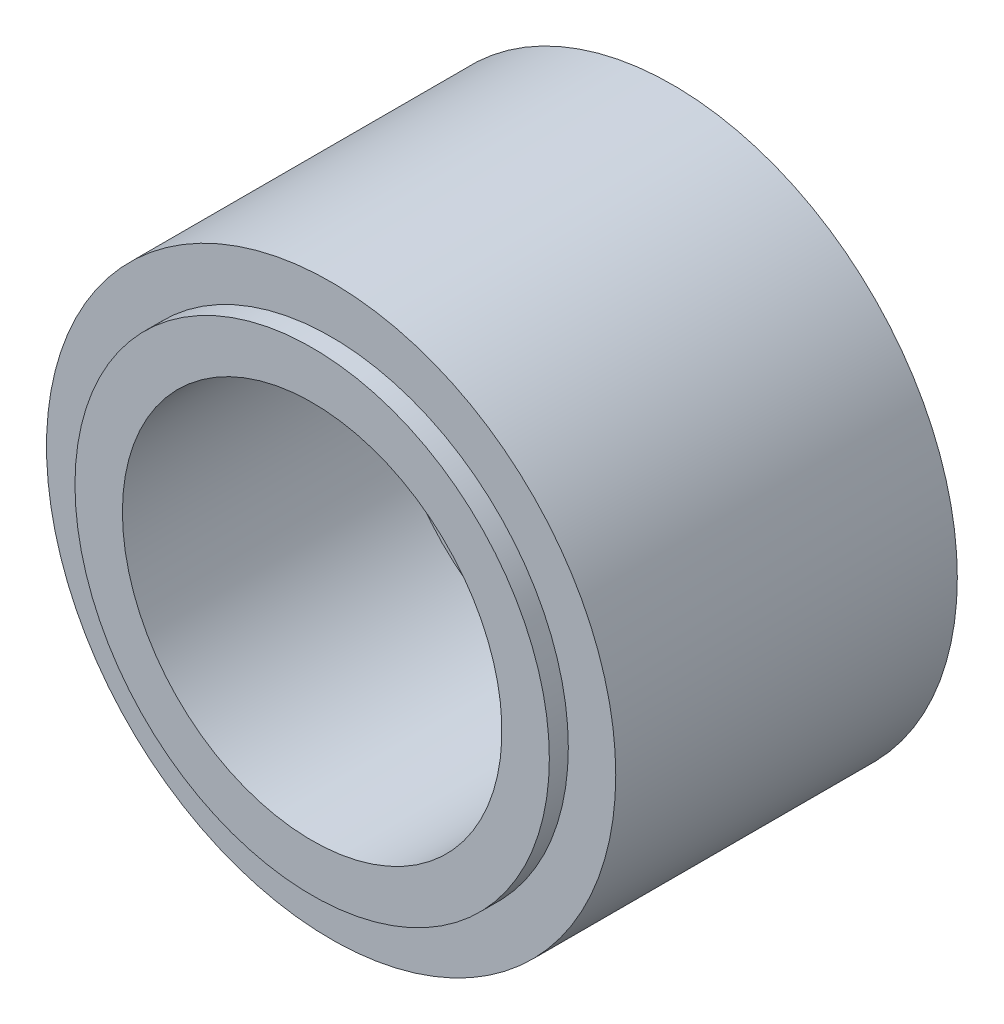
from build123d import *

# Parameters (mm, degrees)
SALIENTE_EXTRUIR1_START = 18
CROQUIS2_R              = 15
CROQUIS2_R_2            = 12.5
SALIENTE_EXTRUIR1_DEPTH = 18


with BuildPart() as part:
    # Croquis1 → Revolución1 (revolve)
    with BuildSketch(Plane(origin=(0, 0, 0), x_dir=(0, 0, -1), z_dir=(1, 0, 0)), mode=Mode.PRIVATE) as revoluci_n1_sk:
        Polygon((0, -1.5), (0, -12.5), (-1, -12.5), (-1, -11), (-19, -11), (-19, -12.5), (-20, -12.5), (-20, -10), (-6, -10), (-6, -1.5), align=None)
    revolve(revoluci_n1_sk.sketch.rotate(Axis((0, 0, 0), (0, 0, 1)), 270), axis=Axis((0, 0, 0), (0, 0, 1)))


with BuildPart() as body_2:
    # Croquis2 → Saliente-Extruir1 (new body)
    with BuildSketch(Plane.XY.offset(1).offset(SALIENTE_EXTRUIR1_START)):
        Circle(CROQUIS2_R)
        Circle(CROQUIS2_R_2, mode=Mode.SUBTRACT)
    extrude(amount=-SALIENTE_EXTRUIR1_DEPTH)


solid = Compound([part.part, body_2.part])
